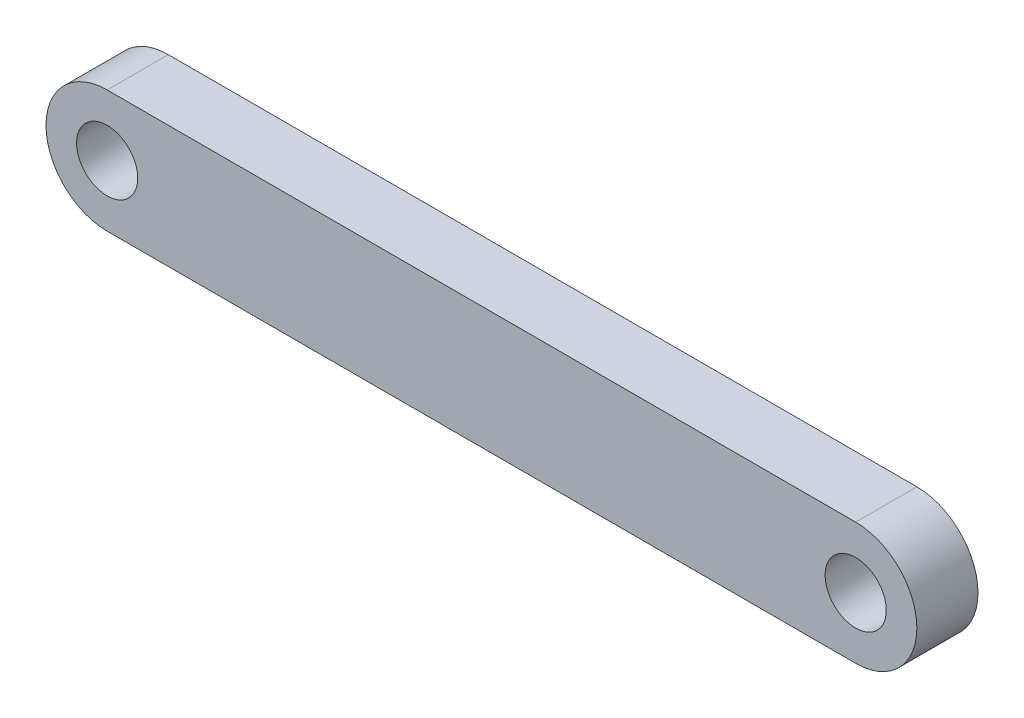
from build123d import *

# Parameters (mm, degrees)
SKETCH_1_R      = 1
EXTRUDE_1_DEPTH = 2


with BuildPart() as part:
    # 草圖1 → 填料-伸長1 (new body)
    with BuildSketch(Plane.XY):
        with BuildLine():
            Line((-12.239999984, 2.000631554), (12.240000016, 2.000631554))
            ThreePointArc((12.240000016, 2.000631554), (14.240000016, 0.000631554), (12.240000016, -1.999368446))
            Line((12.240000016, -1.999368446), (-12.239999984, -1.999368446))
            ThreePointArc((-12.239999984, -1.999368446), (-14.239999984, 0.000631554), (-12.239999984, 2.000631554))
        make_face()
        with Locations((-12.239999984, 0.000631554)):
            Circle(SKETCH_1_R, mode=Mode.SUBTRACT)
        with Locations((12.240000016, 0.000631554)):
            Circle(SKETCH_1_R, mode=Mode.SUBTRACT)
    extrude(amount=EXTRUDE_1_DEPTH)


solid = part.part
